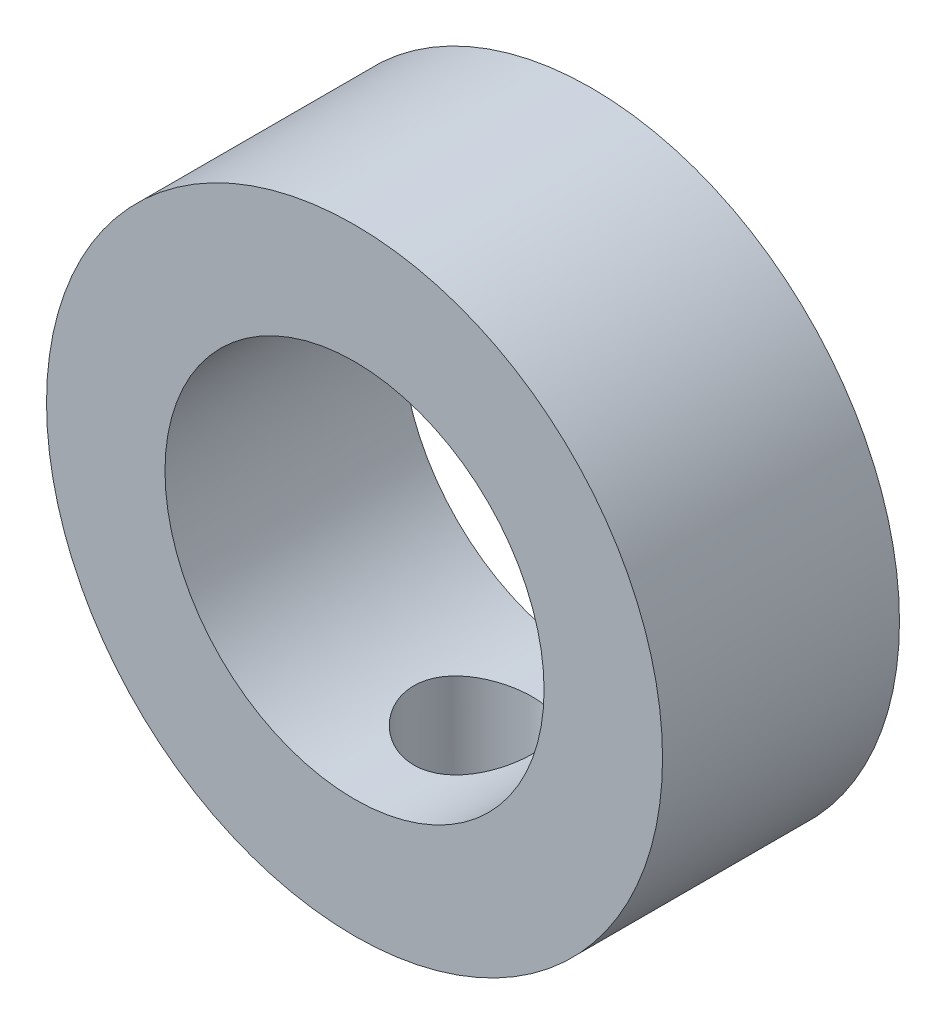
from build123d import *

# Parameters (mm, degrees)
SKETCH1_R           = 6.5
SKETCH1_R_2         = 4
BOSS_EXTRUDE1_DEPTH = 5
SKETCH2_R           = 1.25
CUT_EXTRUDE1_DEPTH  = 11.464224768


with BuildPart() as part:
    # Sketch1 → Boss-Extrude1 (new body)
    with BuildSketch(Plane.XY):
        Circle(SKETCH1_R)
        Circle(SKETCH1_R_2, mode=Mode.SUBTRACT)
    extrude(amount=BOSS_EXTRUDE1_DEPTH)

    # Sketch2 → Cut-Extrude1 (cut, through all)
    with BuildSketch(Plane(origin=(0, 0, 0), x_dir=(1, 0, 0), z_dir=(0, 1, 0))):
        with Locations(Location((0, -2.5, 0), (0, 0, 270))):
            Circle(SKETCH2_R)
    extrude(amount=-CUT_EXTRUDE1_DEPTH, mode=Mode.SUBTRACT)


solid = part.part
